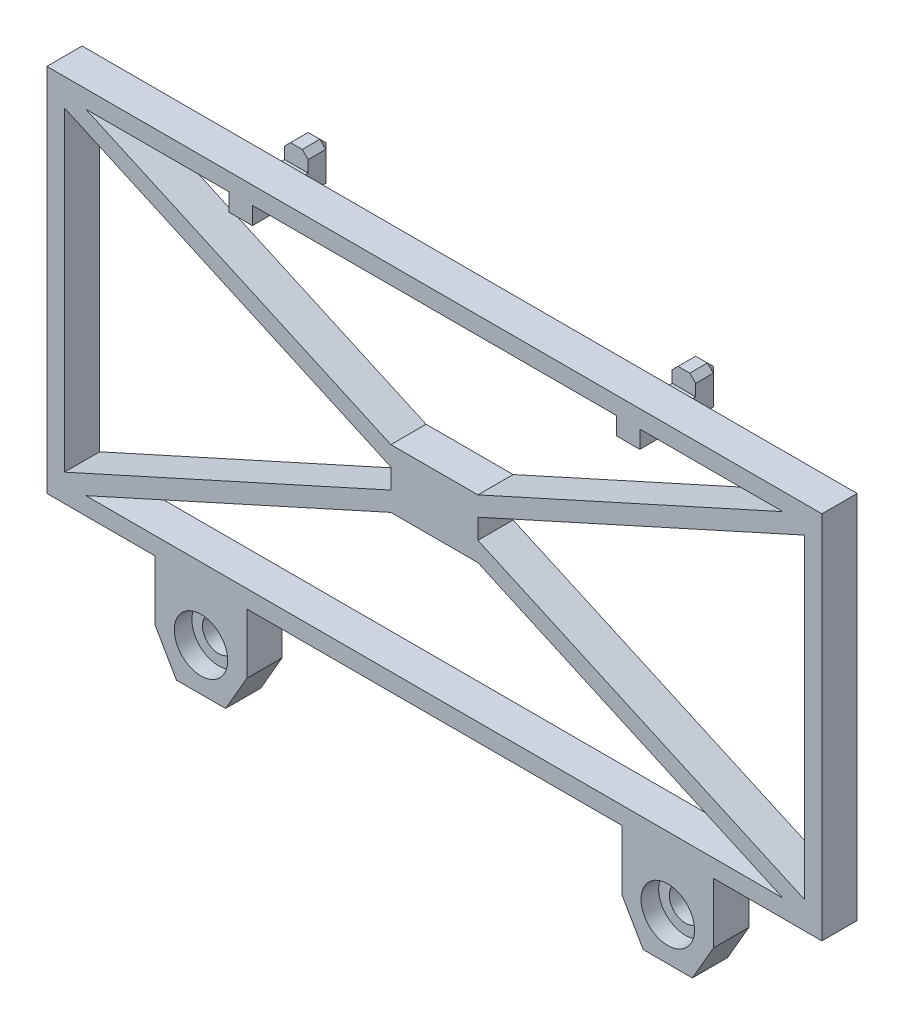
from build123d import *

# Parameters (mm, degrees)
SKETCH1_W                = 66
SKETCH1_H                = 31.5
BOSS_EXTRUDE1_DEPTH      = 3
SKETCH2_R                = 1.375
BOSS_EXTRUDE2_DEPTH      = 3
SKETCH2_4_R              = 2.275
SKETCH2_4_R_2            = 1.375
CUT_EXTRUDE1_DEPTH       = 1.5
BOSS_EXTRUDE3_DEPTH      = 1
CHAMFER1_SIZE            = 0.5
CHAMFER1_OF_MIRROR2_SIZE = 0.5


with BuildPart() as part:
    # Sketch1 → Boss-Extrude1 (new body)
    with BuildSketch(Plane.XY):
        with Locations((0, 0.125155984)):
            Rectangle(SKETCH1_W, SKETCH1_H)
        Polygon((3.706668857, -2.374844016), (29.680353068, -14.124844016), (-29.680353068, -14.124844016), (-3.706668857, -2.374844016), align=None, mode=Mode.SUBTRACT)
        Polygon((-3.706668857, -0.728496791), (-31.5, -13.301670403), (-31.5, 13.551982372), (-3.706668857, 0.97880876), align=None, mode=Mode.SUBTRACT)
        Polygon((-3.706668857, 2.625155984), (-29.680353068, 14.375155984), (29.680353068, 14.375155984), (3.706668857, 2.625155984), align=None, mode=Mode.SUBTRACT)
        Polygon((3.706668857, 0.97880876), (31.5, 13.551982372), (31.5, -13.301670403), (3.706668857, -0.728496791), align=None, mode=Mode.SUBTRACT)
    extrude(amount=BOSS_EXTRUDE1_DEPTH)

    # Sketch2 → Boss-Extrude2 (add)
    with BuildSketch(Plane.XY.offset(3)):
        Polygon((-15.977885683, -15.624844016), (-23.772114317, -15.624844016), (-23.772114317, -20.749844016), (-21.967894726, -23.874844016), (-17.782105274, -23.874844016), (-15.977885683, -20.749844016), align=None)
        with Locations((-19.875, -20.249844016)):
            Circle(SKETCH2_R, mode=Mode.SUBTRACT)
    boss_extrude2 = extrude(amount=-BOSS_EXTRUDE2_DEPTH)

    # Sketch2<4> → Cut-Extrude1 (cut)
    with BuildSketch(Plane.XY.offset(3)):
        with Locations((-19.875, -20.249844016)):
            Circle(SKETCH2_4_R)
        with Locations((-19.875, -20.249844016)):
            Circle(SKETCH2_4_R_2, mode=Mode.SUBTRACT)
    cut_extrude1 = extrude(amount=-CUT_EXTRUDE1_DEPTH, mode=Mode.SUBTRACT)

    # Mirror1: Boss-Extrude2, Cut-Extrude1 across plane
    add(boss_extrude2.mirror(Plane.ZY))
    add(cut_extrude1.mirror(Plane.ZY), mode=Mode.SUBTRACT)

    # Sketch3 → Boss-Extrude3 (add, symmetric)
    with BuildSketch(Plane.ZY.offset(16.5)):
        Polygon((-1.75, 14.375155984), (3, 14.375155984), (3, 12.375155984), (-3.75, 12.375155984), (-3.75, 15.875155984), (-1.75, 15.875155984), align=None)
    boss_extrude3 = extrude(amount=BOSS_EXTRUDE3_DEPTH, both=True)

    # Chamfer1
    chamfer1_edges = [part.edges().sort_by_distance(p)[0] for p in [
        (-16.5, 12.375155984, 3),
        (-15.5, 15.875155984, -2.75),
        (-15.5, 14.125155984, -3.75),
        (-16.5, 15.875155984, -3.75),
        (-15.5, 12.375155984, -0.375),
        (-16.5, 12.375155984, -3.75),
        (-17.5, 15.875155984, -2.75),
        (-17.5, 14.125155984, -3.75),
        (-17.5, 12.375155984, -0.375),
    ]]
    chamfer(chamfer1_edges, length=CHAMFER1_SIZE)

    # Mirror2: Boss-Extrude3 across plane
    add(boss_extrude3.mirror(Plane.ZY))

    # Chamfer1 of Mirror2
    chamfer1_of_mirror2_edges = [part.edges().sort_by_distance(p)[0] for p in [
        (16.5, 12.375155984, 3),
        (15.5, 15.875155984, -2.75),
        (15.5, 14.125155984, -3.75),
        (16.5, 15.875155984, -3.75),
        (15.5, 12.375155984, -0.375),
        (16.5, 12.375155984, -3.75),
        (17.5, 15.875155984, -2.75),
        (17.5, 14.125155984, -3.75),
        (17.5, 12.375155984, -0.375),
    ]]
    chamfer(chamfer1_of_mirror2_edges, length=CHAMFER1_OF_MIRROR2_SIZE)


solid = part.part
